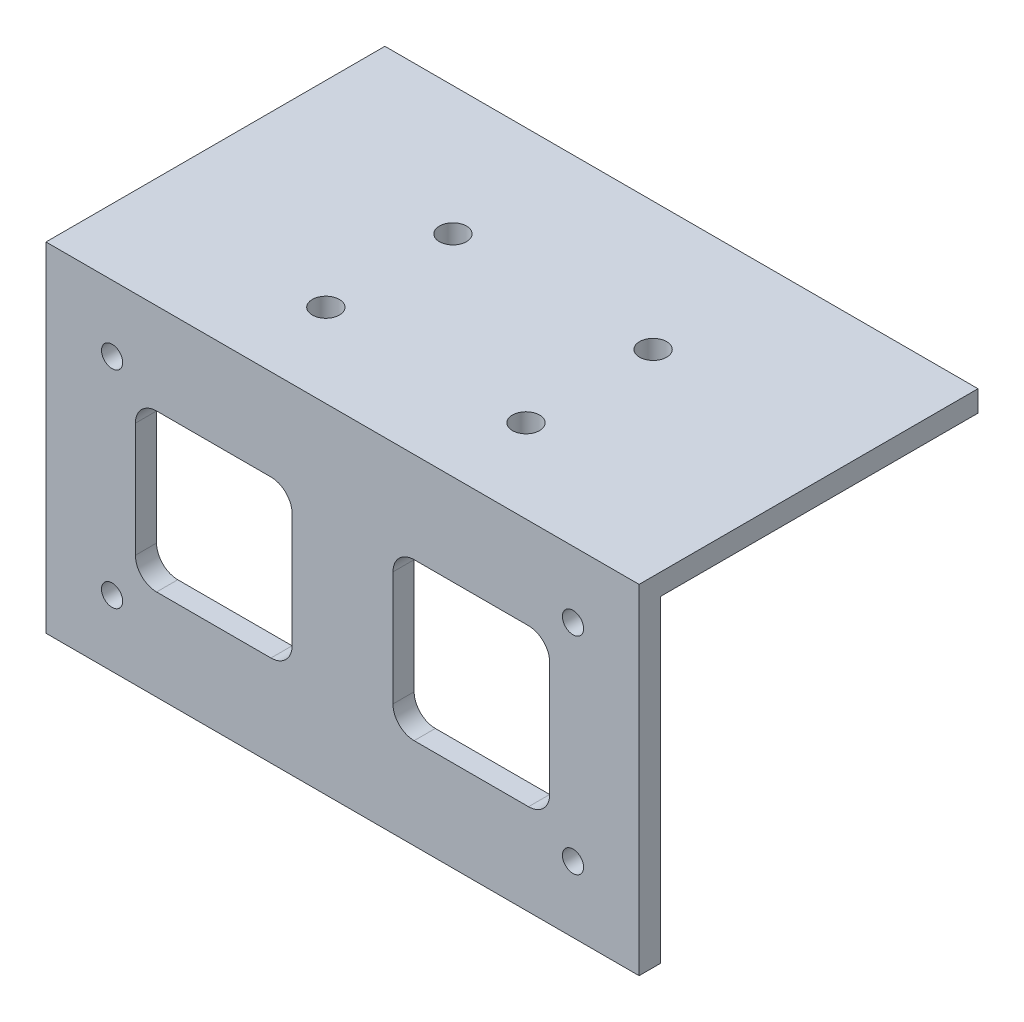
from build123d import *

# Parameters (mm, degrees)
SKETCH1_W           = 177.8
SKETCH1_H           = 101.6
SKETCH1_R           = 3.175
SKETCH1_W_2         = 46.99
SKETCH1_H_2         = 46.99
BOSS_EXTRUDE2_DEPTH = 6.35
SKETCH2_W           = 177.8
SKETCH2_H           = 6.35
BOSS_EXTRUDE3_DEPTH = 95.25
FILLET1_R           = 6.35
SKETCH3_R           = 4.065
CUT_EXTRUDE1_DEPTH  = 152.4


with BuildPart() as part:
    # Sketch1 → Boss-Extrude2 (new body)
    with BuildSketch(Plane.XY):
        Rectangle(SKETCH1_W, SKETCH1_H)
        with Locations((-69.088, 30.988)):
            Circle(SKETCH1_R, mode=Mode.SUBTRACT)
        with Locations((69.088, 30.988)):
            Circle(SKETCH1_R, mode=Mode.SUBTRACT)
        with Locations((69.088, -30.988)):
            Circle(SKETCH1_R, mode=Mode.SUBTRACT)
        with Locations((-69.088, -30.988)):
            Circle(SKETCH1_R, mode=Mode.SUBTRACT)
        with Locations((-38.608, 0)):
            Rectangle(SKETCH1_W_2, SKETCH1_H_2, mode=Mode.SUBTRACT)
        with Locations((38.608, 0)):
            Rectangle(SKETCH1_W_2, SKETCH1_H_2, mode=Mode.SUBTRACT)
    extrude(amount=BOSS_EXTRUDE2_DEPTH)

    # Sketch2 → Boss-Extrude3 (add)
    with BuildSketch(Plane(origin=(0, 0, 0), x_dir=(-1, 0, 0), z_dir=(0, 0, -1))):
        with Locations((0, 47.625)):
            Rectangle(SKETCH2_W, SKETCH2_H)
    extrude(amount=BOSS_EXTRUDE3_DEPTH)

    # Fillet1
    fillet1_edges = [part.edges().sort_by_distance(p)[0] for p in [
        (15.113, 23.495, 3.175),
        (15.113, -23.495, 3.175),
        (62.103, -23.495, 3.175),
        (62.103, 23.495, 3.175),
        (-62.103, 23.495, 3.175),
        (-62.103, -23.495, 3.175),
        (-15.113, -23.495, 3.175),
        (-15.113, 23.495, 3.175),
    ]]
    fillet(fillet1_edges, radius=FILLET1_R)

    # Sketch3 → Cut-Extrude1 (cut)
    with BuildSketch(Plane(origin=(0, 50.8, 0), x_dir=(1, 0, 0), z_dir=(0, 1, 0))):
        with Locations(Location((-30, 18.65, 0), (0, 0, 270))):
            Circle(SKETCH3_R)
        with Locations(Location((-30, 56.75, 0), (0, 0, 270))):
            Circle(SKETCH3_R)
        with Locations(Location((30, 18.65, 0), (0, 0, 270))):
            Circle(SKETCH3_R)
        with Locations(Location((30, 56.75, 0), (0, 0, 270))):
            Circle(SKETCH3_R)
    extrude(amount=-CUT_EXTRUDE1_DEPTH, mode=Mode.SUBTRACT)


solid = part.part
